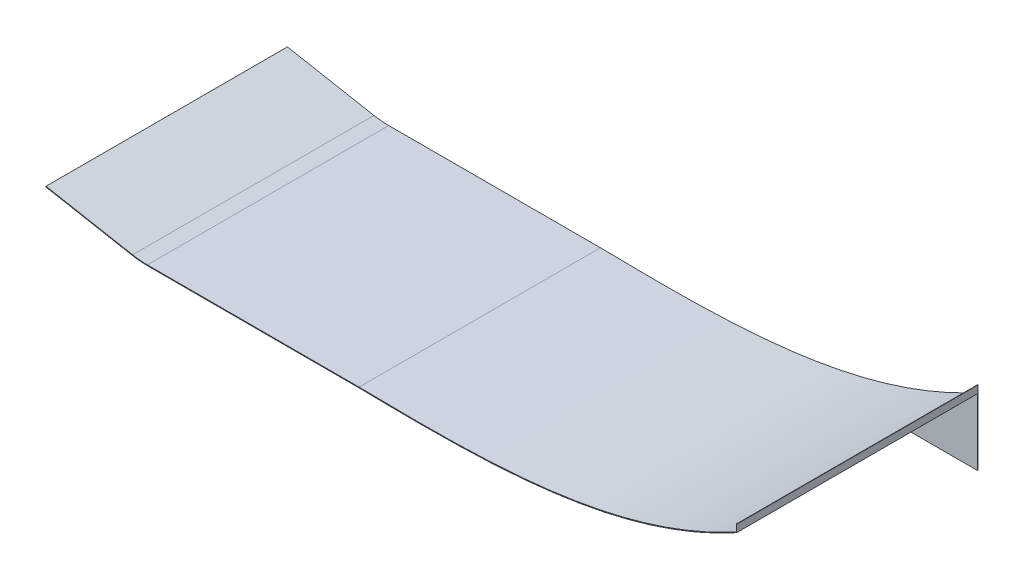
from build123d import *

# Parameters (mm, degrees)
BOSS_EXTRUDE4_DEPTH = 656
BOSS_EXTRUDE5_DEPTH = 2
BOSS_EXTRUDE9_DEPTH = 2
LPATTERN3_COUNT     = 4
LPATTERN3_PITCH     = 131.2


with BuildPart() as part:
    # Sketch1 → Boss-Extrude4 (new body)
    with BuildSketch(Plane.XY):
        with BuildLine():
            Line((20.215160167, 0), (595.62, 0))
            add(Edge.make_bspline(
                [(595.62, 0), (948.042476236, -6.051882856), (1296.653371581, -5.972838331), (1620.872435085, 172.120900396)],
                knots=[0, 0, 0, 0, 1, 1, 1, 1], degree=3))
            Line((1620.872435085, 172.120900396), (1620.835331221, 190.367951158))
            Line((1620.835331221, 190.367951158), (1621.835331221, 190.367951158))
            Line((1621.835331221, 190.367951158), (1621.835331221, 170.367951158))
            add(Edge.make_bspline(
                [(1621.835331221, 170.367951158), (1616.774793048, 167.588194307), (1606.594882115, 162.089975973), (1586.237103283, 151.463515801), (1560.685949999, 138.804453476), (1529.896447866, 124.599348202), (1488.666109159, 106.924955829), (1436.810578156, 87.129638764), (1374.105679417, 66.798567899), (1310.954471427, 49.638805996), (1226.199224704, 30.650867762), (1119.294939682, 13.581661927), (989.717791405, 1.743158227), (859.093886549, -3.470659935), (749.560168834, -3.976722534), (661.665201283, -3.086995239), (617.614395377, -2.377975559), (595.602829307, -2)],
                knots=[1.6238e-05, 1.6238e-05, 1.6238e-05, 1.6238e-05, 0.015640984, 0.03126573, 0.062515223, 0.093764715, 0.125014208, 0.187513193, 0.250012178, 0.312511163, 0.375010149, 0.500008119, 0.625006089, 0.750004059, 0.87500203, 0.937501015, 1, 1, 1, 1], degree=3))
            Line((595.602829307, -2), (20.031385984, -2))
            ThreePointArc((20.031385984, -2), (-0.098970122, -1.077084066), (-20.060429625, 1.683920336))
            Line((-20.060429625, 1.683920336), (-255.32838496, 45.288258481))
            Line((-255.32838496, 45.288258481), (-255.32838496, 47.322319012))
            Line((-255.32838496, 47.322319012), (-19.876655441, 3.683920336))
            ThreePointArc((-19.876655441, 3.683920336), (0.084804061, 0.922915934), (20.215160167, 0))
        make_face()
    extrude(amount=BOSS_EXTRUDE4_DEPTH)

    # Sketch3 → Boss-Extrude5 (add)
    with BuildSketch(Plane.XY):
        with BuildLine():
            Line((1621.835331221, -10), (-255.32838496, -10))
            Line((-255.32838496, -10), (-255.32838496, 45.288258481))
            Line((-255.32838496, 45.288258481), (-20.060429625, 1.683920336))
            ThreePointArc((-20.060429625, 1.683920336), (-0.098970122, -1.077084066), (20.031385984, -2))
            Line((20.031385984, -2), (595.602829307, -2))
            add(Edge.make_bspline(
                [(1621.835331221, 170.367951158), (1616.774793048, 167.588194307), (1606.594882115, 162.089975973), (1586.237103283, 151.463515801), (1560.685949999, 138.804453476), (1529.896447866, 124.599348202), (1488.666109159, 106.924955829), (1436.810578156, 87.129638764), (1374.105679417, 66.798567899), (1310.954471427, 49.638805996), (1226.199224704, 30.650867762), (1119.294939682, 13.581661927), (989.717791405, 1.743158227), (859.093886549, -3.470659935), (749.560168834, -3.976722534), (661.665201283, -3.086995239), (617.614395377, -2.377975559), (595.602829307, -2)],
                knots=[1.6238e-05, 1.6238e-05, 1.6238e-05, 1.6238e-05, 0.015640984, 0.03126573, 0.062515223, 0.093764715, 0.125014208, 0.187513193, 0.250012178, 0.312511163, 0.375010149, 0.500008119, 0.625006089, 0.750004059, 0.87500203, 0.937501015, 1, 1, 1, 1], degree=3))
            Line((1621.835331221, 170.367951158), (1621.835331221, -10))
        make_face()
    extrude(amount=BOSS_EXTRUDE5_DEPTH)

    # Sketch7 → Boss-Extrude9 (add)
    with BuildSketch(Plane.XY.offset(131.2)):
        with BuildLine():
            Line((-19.876655441, 3.683920336), (-255.32838496, 47.322319012))
            Line((-255.32838496, 47.322319012), (-255.32838496, 0))
            Line((-255.32838496, 0), (20.215160167, 0))
            ThreePointArc((20.215160167, 0), (0.084804061, 0.922915934), (-19.876655441, 3.683920336))
        make_face()
    boss_extrude9 = extrude(amount=BOSS_EXTRUDE9_DEPTH)

    # LPattern3: Boss-Extrude9 ×4
    with Locations(*[(0, 0, i * LPATTERN3_PITCH) for i in range(1, LPATTERN3_COUNT)]):
        add(boss_extrude9)


solid = part.part
